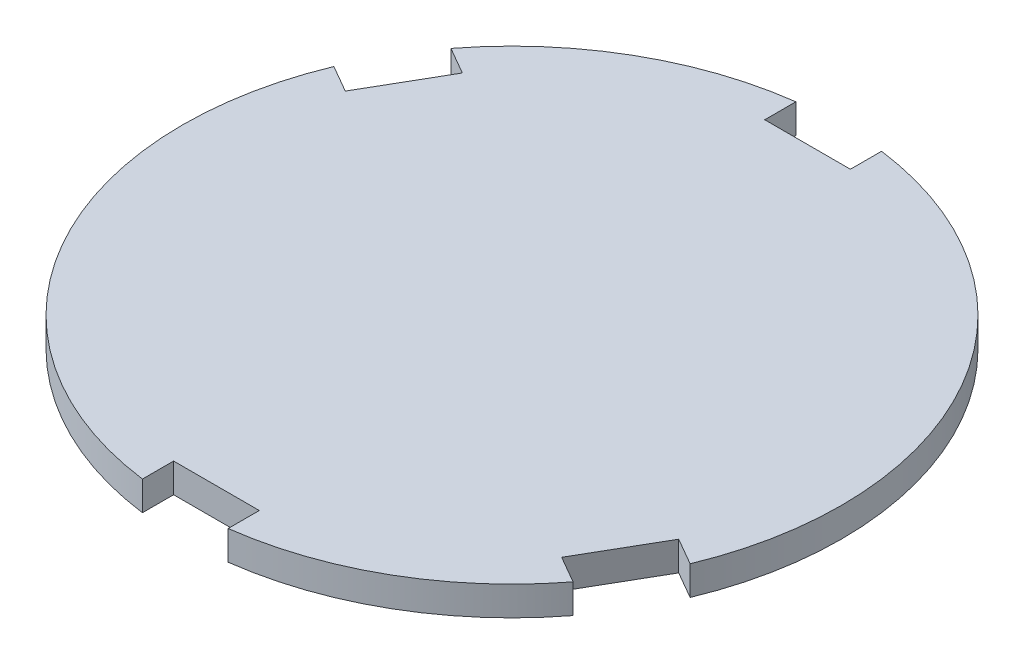
from build123d import *

# Parameters (mm, degrees)
SKETCH1_R           = 53.721
BOSS_EXTRUDE1_DEPTH = 4.7625
CUT_EXTRUDE1_REACH  = 78.122
CUT_EXTRUDE2_REACH  = 77.801


with BuildPart() as part:
    # Sketch1 → Boss-Extrude1 (new body)
    with BuildSketch(Plane(origin=(0, 0, 0), x_dir=(1, 0, 0), z_dir=(0, 1, 0))):
        with Locations(Location((0, 0, 0), (0, 0, 90))):
            Circle(SKETCH1_R)
    extrude(amount=BOSS_EXTRUDE1_DEPTH)

    # Sketch2 → Cut-Extrude1 (cut, up to next)
    with BuildSketch(Plane(origin=(0, 4.7625, 0), x_dir=(1, 0, 0), z_dir=(0, 1, 0)), mode=Mode.PRIVATE) as cut_extrude1_sk1:
        with BuildLine():
            Line((-6.985, -48.184956735), (6.985, -48.184956735))
            Line((6.985, -48.184956735), (6.985, -53.264956735))
            ThreePointArc((6.985, -53.264956735), (0, -53.721), (-6.985, -53.264956735))
            Line((-6.985, -53.264956735), (-6.985, -48.184956735))
        make_face()
    cut_extrude1_tool1 = extrude(cut_extrude1_sk1.sketch, amount=-CUT_EXTRUDE1_REACH, mode=Mode.PRIVATE) & part.part
    # Sketch2 → Cut-Extrude1 (cut, up to next)
    with BuildSketch(Plane(origin=(0, 4.7625, 0), x_dir=(1, 0, 0), z_dir=(0, 1, 0)), mode=Mode.PRIVATE) as cut_extrude1_sk2:
        with BuildLine():
            Line((6.985, 48.184956735), (6.985, 53.264956735))
            ThreePointArc((6.985, 53.264956735), (0, 53.721), (-6.985, 53.264956735))
            Line((-6.985, 53.264956735), (-6.985, 48.184956735))
            Line((-6.985, 48.184956735), (6.985, 48.184956735))
        make_face()
    cut_extrude1_tool2 = extrude(cut_extrude1_sk2.sketch, amount=-CUT_EXTRUDE1_REACH, mode=Mode.PRIVATE) & part.part
    add(cut_extrude1_tool1.solids().sort_by_distance((0, 4.7625, 50.878815))[0], mode=Mode.SUBTRACT)
    add(cut_extrude1_tool2.solids().sort_by_distance((0, 4.7625, -50.878815))[0], mode=Mode.SUBTRACT)

    # Sketch3 → Cut-Extrude2 (cut, up to next)
    with BuildSketch(Plane(origin=(0, 4.7625, 0), x_dir=(1, 0, 0), z_dir=(0, 1, 0)), mode=Mode.PRIVATE) as cut_extrude2_sk1:
        with BuildLine():
            Line((38.236896613, -30.141665813), (45.221896613, -18.043290922))
            Line((45.221896613, -18.043290922), (49.621305664, -20.583290922))
            ThreePointArc((49.621305664, -20.583290922), (46.523750717, -26.8605), (42.636305664, -32.681665813))
            Line((42.636305664, -32.681665813), (38.236896613, -30.141665813))
        make_face()
    cut_extrude2_tool1 = extrude(cut_extrude2_sk1.sketch, amount=-CUT_EXTRUDE2_REACH, mode=Mode.PRIVATE) & part.part
    # Sketch3 → Cut-Extrude2 (cut, up to next)
    with BuildSketch(Plane(origin=(0, 4.7625, 0), x_dir=(1, 0, 0), z_dir=(0, 1, 0)), mode=Mode.PRIVATE) as cut_extrude2_sk2:
        with BuildLine():
            Line((-45.221896613, 18.043290922), (-49.621305664, 20.583290922))
            ThreePointArc((-49.621305664, 20.583290922), (-46.523750717, 26.8605), (-42.636305664, 32.681665813))
            Line((-42.636305664, 32.681665813), (-38.236896613, 30.141665813))
            Line((-38.236896613, 30.141665813), (-45.221896613, 18.043290922))
        make_face()
    cut_extrude2_tool2 = extrude(cut_extrude2_sk2.sketch, amount=-CUT_EXTRUDE2_REACH, mode=Mode.PRIVATE) & part.part
    add(cut_extrude2_tool1.solids().sort_by_distance((44.062347, 4.7625, 25.439408))[0], mode=Mode.SUBTRACT)
    add(cut_extrude2_tool2.solids().sort_by_distance((-44.062347, 4.7625, -25.439408))[0], mode=Mode.SUBTRACT)


solid = part.part
